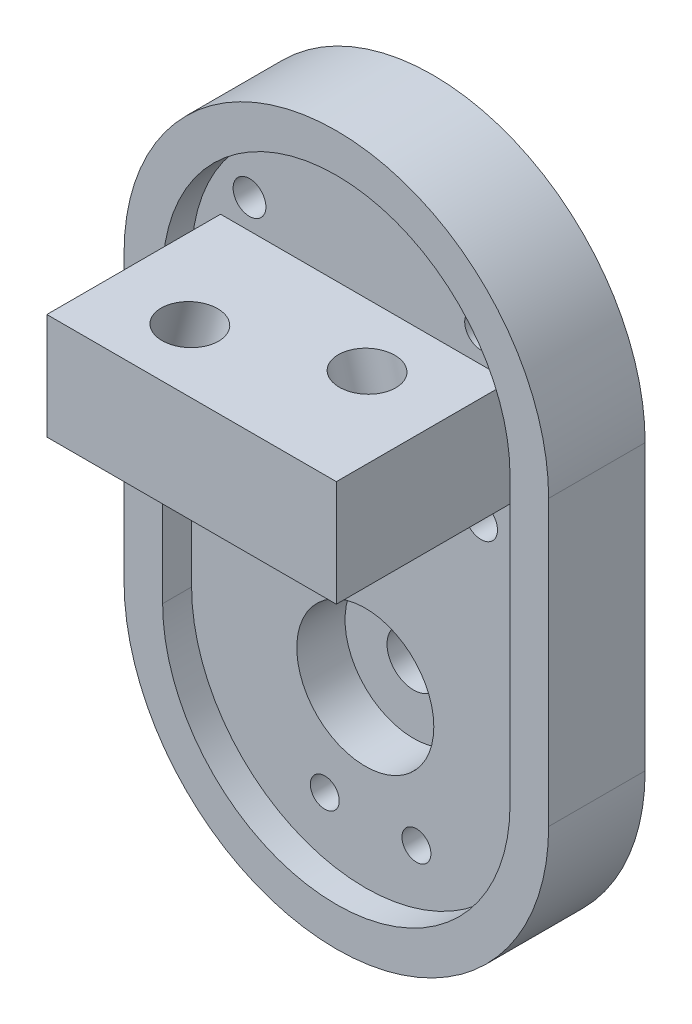
from build123d import *

# Parameters (mm, degrees)
BOSS_EXTRUDE1_DEPTH = 7
SKETCH2_R           = 2.75
CUT_EXTRUDE1_DEPTH  = 56.14752941
SKETCH3_R           = 7.1
CUT_EXTRUDE2_DEPTH  = 5
CUT_EXTRUDE3_REACH  = 57.148
SKETCH6_R           = 1.7
SKETCH9_W           = 30
SKETCH9_H           = 11
BOSS_EXTRUDE2_DEPTH = 18
SKETCH12_R          = 1.5
CUT_EXTRUDE5_DEPTH  = 61.143578211
CHAMFER2_SIZE       = 1
BOSS_EXTRUDE3_DEPTH = 5
CUT_EXTRUDE6_DEPTH  = 58.586890869
BOSS_EXTRUDE4_START = 3
BOSS_EXTRUDE4_DEPTH = 3


with BuildPart() as part:
    # Sketch1 → Boss-Extrude1 (new body)
    with BuildSketch(Plane.XY):
        with BuildLine():
            Line((-28.559544782, -15.511363636), (-19.332614929, -32.5))
            ThreePointArc((-19.332614929, -32.5), (0, -44), (19.332614929, -32.5))
            Line((19.332614929, -32.5), (28.559544782, -15.511363636))
            ThreePointArc((28.559544782, -15.511363636), (0, 32.5), (-28.559544782, -15.511363636))
        make_face()
    extrude(amount=BOSS_EXTRUDE1_DEPTH)

    # Sketch2 → Cut-Extrude1 (cut, through all)
    with BuildSketch(Plane.XY.offset(7)):
        with Locations((0, -22)):
            Circle(SKETCH2_R)
    extrude(amount=-CUT_EXTRUDE1_DEPTH, mode=Mode.SUBTRACT)

    # Sketch3 → Cut-Extrude2 (cut)
    with BuildSketch(Plane.XY.offset(7)):
        with Locations((0, -22)):
            Circle(SKETCH3_R)
    extrude(amount=-CUT_EXTRUDE2_DEPTH, mode=Mode.SUBTRACT)

    # Sketch6 → Cut-Extrude3 (cut, up to next)
    with BuildSketch(Plane.XY.offset(7), mode=Mode.PRIVATE) as cut_extrude3_sk1:
        with Locations((-12, 15.95)):
            Circle(SKETCH6_R)
    cut_extrude3_tool1 = extrude(cut_extrude3_sk1.sketch, amount=-CUT_EXTRUDE3_REACH, mode=Mode.PRIVATE) & part.part
    # Sketch6 → Cut-Extrude3 (cut, up to next)
    with BuildSketch(Plane.XY.offset(7), mode=Mode.PRIVATE) as cut_extrude3_sk2:
        with Locations((12, 15.95)):
            Circle(SKETCH6_R)
    cut_extrude3_tool2 = extrude(cut_extrude3_sk2.sketch, amount=-CUT_EXTRUDE3_REACH, mode=Mode.PRIVATE) & part.part
    # Sketch6 → Cut-Extrude3 (cut, up to next)
    with BuildSketch(Plane.XY.offset(7), mode=Mode.PRIVATE) as cut_extrude3_sk3:
        with Locations((-12, -1.05)):
            Circle(SKETCH6_R)
    cut_extrude3_tool3 = extrude(cut_extrude3_sk3.sketch, amount=-CUT_EXTRUDE3_REACH, mode=Mode.PRIVATE) & part.part
    # Sketch6 → Cut-Extrude3 (cut, up to next)
    with BuildSketch(Plane.XY.offset(7), mode=Mode.PRIVATE) as cut_extrude3_sk4:
        with Locations((12, -1.05)):
            Circle(SKETCH6_R)
    cut_extrude3_tool4 = extrude(cut_extrude3_sk4.sketch, amount=-CUT_EXTRUDE3_REACH, mode=Mode.PRIVATE) & part.part
    add(cut_extrude3_tool1.solids().sort_by_distance((-12, 15.95, 7))[0], mode=Mode.SUBTRACT)
    add(cut_extrude3_tool2.solids().sort_by_distance((12, 15.95, 7))[0], mode=Mode.SUBTRACT)
    add(cut_extrude3_tool3.solids().sort_by_distance((-12, -1.05, 7))[0], mode=Mode.SUBTRACT)
    add(cut_extrude3_tool4.solids().sort_by_distance((12, -1.05, 7))[0], mode=Mode.SUBTRACT)

    # Sketch9 → Boss-Extrude2 (add)
    with BuildSketch(Plane.XY.offset(7)):
        with Locations((0, 7.45)):
            Rectangle(SKETCH9_W, SKETCH9_H)
    extrude(amount=BOSS_EXTRUDE2_DEPTH)

    # Sketch10 → Cut-Revolve1 (revolve, cut)
    with BuildSketch(Plane.XY.offset(18.5)):
        Polygon((-10.364859929, -0.79478264), (-6.482574253, 13.694104755), (-9.259611003, 14.438209509), (-11.071344319, 7.676728725), (-9.260233395, 7.191443016), (-11.330785756, -0.535963595), align=None)
    revolve(axis=Axis((-10.364859929, -0.79478264, 18.5), (0.25881904510252135, 0.9659258262890681, 0)), mode=Mode.SUBTRACT)

    # Sketch11 → Cut-Revolve2 (revolve, cut)
    with BuildSketch(Plane.XY.offset(13.5)):
        Polygon((10.364859929, -0.79478264), (6.482574253, 13.694104755), (3.705537502, 12.95), (5.517270818, 6.188519216), (7.328381742, 6.673804926), (9.398934103, -1.053601685), align=None)
    revolve(axis=Axis((10.364859929, -0.79478264, 13.5), (-0.258819045102522, 0.965925826289068, 0)), mode=Mode.SUBTRACT)

    # Sketch12 → Cut-Extrude5 (cut, through all)
    with BuildSketch(Plane(origin=(0, 0, 0), x_dir=(-1, 0, 0), z_dir=(0, 0, -1))):
        with Locations((-5.3, -33.55)):
            Circle(SKETCH12_R)
        with Locations((4.2, -33.55)):
            Circle(SKETCH12_R)
    extrude(amount=-CUT_EXTRUDE5_DEPTH, mode=Mode.SUBTRACT)

    # Chamfer2
    chamfer2_edges = [part.edges().sort_by_distance(p)[0] for p in [
        (-2.7, -33.55, 0),
        (6.8, -33.55, 0),
    ]]
    chamfer(chamfer2_edges, length=CHAMFER2_SIZE)

    # Sketch13 → Boss-Extrude3 (add, symmetric)
    with BuildSketch(Plane(origin=(0, 0, 0), x_dir=(0, 0, -1), z_dir=(1, 0, 0))):
        Polygon((-25, 1.95), (-7, -6), (-7, 1.95), align=None)
    extrude(amount=BOSS_EXTRUDE3_DEPTH, both=True)

    # Sketch14 → Cut-Extrude6 (cut, through all)
    with BuildSketch(Plane.XY.offset(7)):
        with BuildLine():
            Line((-22, 7.45), (-22, -22))
            ThreePointArc((-22, -22), (-21.322728817, -27.416755097), (-19.332614929, -32.5))
            Line((-19.332614929, -32.5), (-28.559544782, -15.511363636))
            ThreePointArc((-28.559544782, -15.511363636), (0, 32.5), (28.559544782, -15.511363636))
            Line((28.559544782, -15.511363636), (19.332614929, -32.5))
            ThreePointArc((19.332614929, -32.5), (21.322728817, -27.416755097), (22, -22))
            Line((22, -22), (22, 7.45))
            ThreePointArc((22, 7.45), (0, 29.45), (-22, 7.45))
        make_face()
    extrude(amount=-CUT_EXTRUDE6_DEPTH, mode=Mode.SUBTRACT)

    # Sketch15 → Boss-Extrude4 (add)
    with BuildSketch(Plane.XY.offset(7).offset(BOSS_EXTRUDE4_START)):
        with BuildLine():
            Line((-22, 7.45), (-22, -22))
            ThreePointArc((-22, -22), (0, -44), (22, -22))
            Line((22, -22), (22, 7.45))
            ThreePointArc((22, 7.45), (0, 29.45), (-22, 7.45))
        make_face()
        with BuildLine():
            Line((-18, 7.45), (-18, -22))
            ThreePointArc((-18, -22), (0, -40), (18, -22))
            Line((18, -22), (18, 7.45))
            ThreePointArc((18, 7.45), (0, 25.45), (-18, 7.45))
        make_face(mode=Mode.SUBTRACT)
    extrude(amount=-BOSS_EXTRUDE4_DEPTH)


solid = part.part
